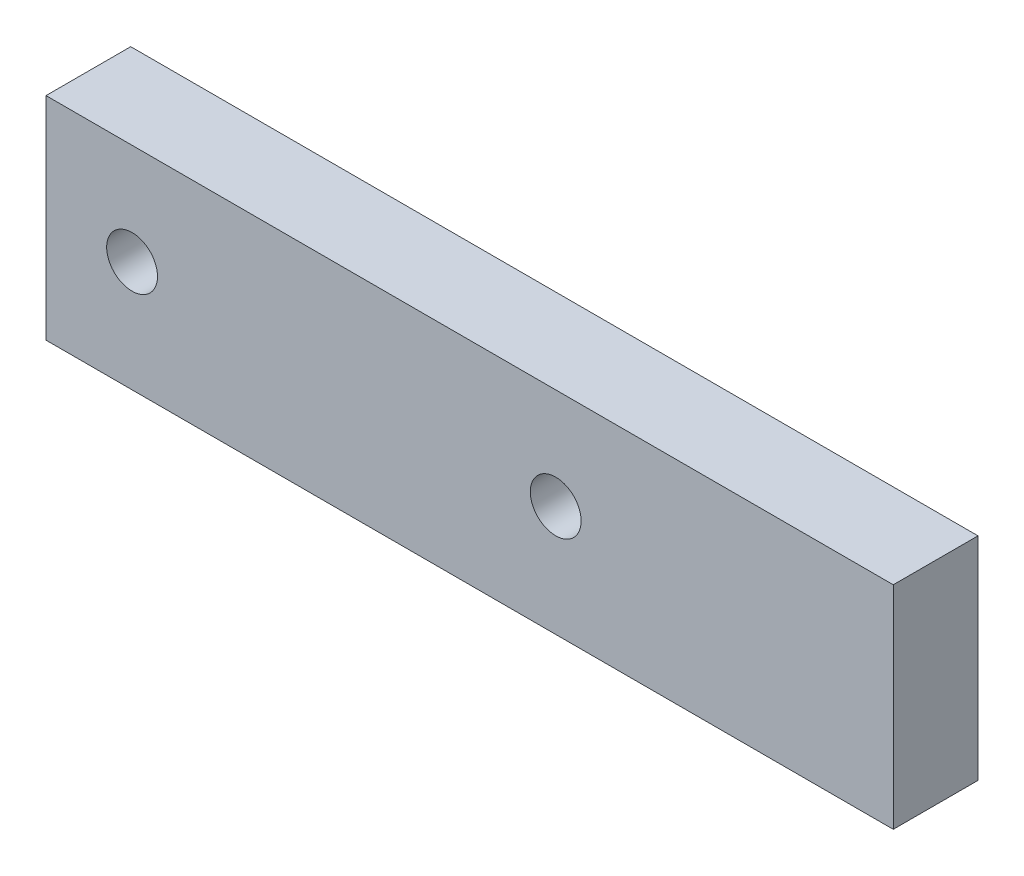
from build123d import *

# Parameters (mm, degrees)
SKETCH1_W           = 100
SKETCH1_H           = 25
BOSS_EXTRUDE1_DEPTH = 10
SKETCH2_R           = 3
CUT_EXTRUDE1_DEPTH  = 10
SKETCH3_R           = 3
CUT_EXTRUDE2_DEPTH  = 10


with BuildPart() as part:
    # Sketch1 → Boss-Extrude1 (new body)
    with BuildSketch(Plane.XY):
        with Locations((12.340425532, -0.585106383)):
            Rectangle(SKETCH1_W, SKETCH1_H)
    extrude(amount=BOSS_EXTRUDE1_DEPTH)

    # Sketch2 → Cut-Extrude1 (cut)
    with BuildSketch(Plane.XY.offset(10)):
        with Locations((-27.500414685, 0)):
            Circle(SKETCH2_R)
    extrude(amount=-CUT_EXTRUDE1_DEPTH, mode=Mode.SUBTRACT)

    # Sketch3 → Cut-Extrude2 (cut)
    with BuildSketch(Plane.XY.offset(10)):
        with Locations((22.499585315, 0)):
            Circle(SKETCH3_R)
    extrude(amount=-CUT_EXTRUDE2_DEPTH, mode=Mode.SUBTRACT)


solid = part.part
